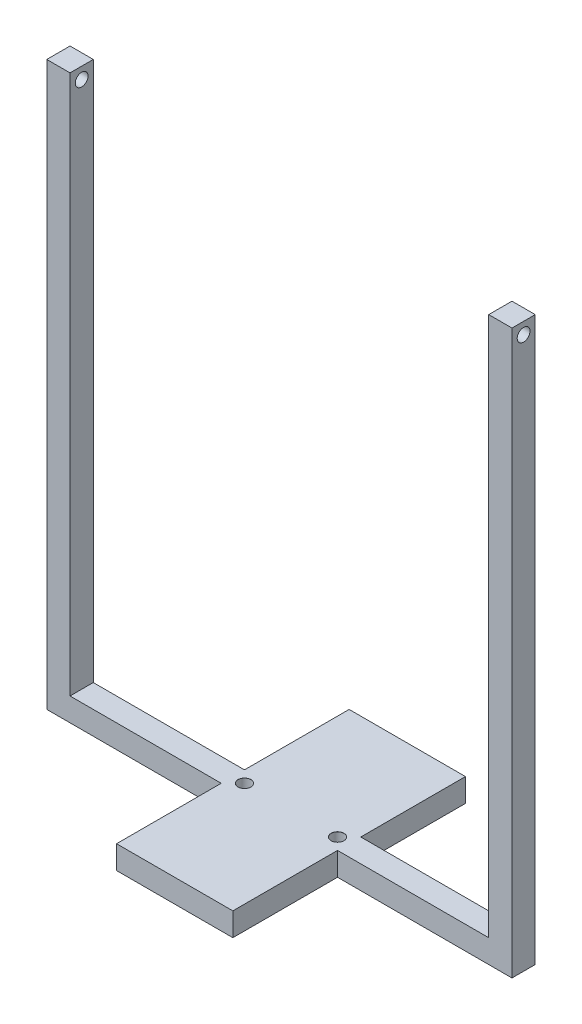
from build123d import *

# Parameters (mm, degrees)
SKETCH1_R                      = 10
BOSS_EXTRUDE1_DEPTH            = 10
SKETCH4_R                      = 15
BOSS_EXTRUDE4_DEPTH            = 5
BOSS_EXTRUDE2_DEPTH            = 10
SKETCH3_W                      = 10
SKETCH3_H                      = 10
BOSS_EXTRUDE3_DEPTH            = 232
M5_CLEARANCE_HOLE1_D           = 5.5
M5_CLEARANCE_HOLE1_CSINK_D     = 5.55
M5_CLEARANCE_HOLE1_CSINK_ANGLE = 90
M5_CLEARANCE_HOLE2_D           = 5.5
M5_CLEARANCE_HOLE2_CSINK_D     = 5.55
M5_CLEARANCE_HOLE2_CSINK_ANGLE = 90


with BuildPart() as part:
    # Sketch1 → Boss-Extrude1 (new body)
    with BuildSketch(Plane(origin=(0, 0, 0), x_dir=(1, 0, 0), z_dir=(0, 1, 0))):
        with Locations(Location((0, 0, 0), (0, 0, 270))):
            Circle(SKETCH1_R)
    extrude(amount=BOSS_EXTRUDE1_DEPTH)

    # Sketch4 → Boss-Extrude4 (add)
    with BuildSketch(Plane(origin=(0, 10, 0), x_dir=(1, 0, 0), z_dir=(0, 1, 0))):
        with Locations(Location((0, 0, 0), (0, 0, 270))):
            Circle(SKETCH4_R)
    extrude(amount=BOSS_EXTRUDE4_DEPTH)

    # Sketch2 → Boss-Extrude2 (add)
    with BuildSketch(Plane(origin=(0, 15, 0), x_dir=(1, 0, 0), z_dir=(0, 1, 0))):
        with BuildLine():
            Line((-25, 50), (-25, 5))
            Line((-25, 5), (-14.142135624, 5))
            ThreePointArc((-14.142135624, 5), (0, 15), (14.142135624, 5))
            Line((14.142135624, 5), (25, 5))
            Line((25, 5), (25, 50))
            Line((25, 50), (-25, 50))
        make_face()
        with BuildLine():
            Line((-14.142135624, 5), (-25, 5))
            Line((-25, 5), (-100, 5))
            Line((-100, 5), (-100, -5))
            Line((-100, -5), (-25, -5))
            Line((-25, -5), (-14.142135624, -5))
            ThreePointArc((-14.142135624, -5), (-15, 0), (-14.142135624, 5))
        make_face()
        with BuildLine():
            ThreePointArc((14.142135624, -5), (0, -15), (-14.142135624, -5))
            Line((-14.142135624, -5), (-25, -5))
            Line((-25, -5), (-25, -50))
            Line((-25, -50), (25, -50))
            Line((25, -50), (25, -5))
            Line((25, -5), (14.142135624, -5))
        make_face()
        with BuildLine():
            Line((25, 5), (14.142135624, 5))
            ThreePointArc((14.142135624, 5), (14.783978395, 2.536529681), (15, 0))
            ThreePointArc((15, 0), (14.783978395, -2.536529681), (14.142135624, -5))
            Line((14.142135624, -5), (25, -5))
            Line((25, -5), (100, -5))
            Line((100, -5), (100, 5))
            Line((100, 5), (25, 5))
        make_face()
        with BuildLine():
            Line((14.142135624, 5), (-14.142135624, 5))
            ThreePointArc((-14.142135624, 5), (-15, 0), (-14.142135624, -5))
            Line((-14.142135624, -5), (14.142135624, -5))
            ThreePointArc((14.142135624, -5), (14.783978395, -2.536529681), (15, 0))
            ThreePointArc((15, 0), (14.783978395, 2.536529681), (14.142135624, 5))
        make_face()
        with BuildLine():
            ThreePointArc((14.142135624, 5), (0, 15), (-14.142135624, 5))
            Line((-14.142135624, 5), (14.142135624, 5))
        make_face()
        with BuildLine():
            Line((14.142135624, -5), (-14.142135624, -5))
            ThreePointArc((-14.142135624, -5), (0, -15), (14.142135624, -5))
        make_face()
    extrude(amount=BOSS_EXTRUDE2_DEPTH)

    # Sketch3 → Boss-Extrude3 (add)
    with BuildSketch(Plane(origin=(0, 25, 0), x_dir=(1, 0, 0), z_dir=(0, 1, 0))):
        with Locations((-95, 0)):
            Rectangle(SKETCH3_W, SKETCH3_H)
        with Locations((95, 0)):
            Rectangle(SKETCH3_W, SKETCH3_H)
    extrude(amount=BOSS_EXTRUDE3_DEPTH)

    # M5 Clearance Hole1 (through all)
    with Locations(Plane.ZY.offset(100)):
        with Locations((0, 252)):
            CounterSinkHole(M5_CLEARANCE_HOLE1_D / 2, M5_CLEARANCE_HOLE1_CSINK_D / 2, counter_sink_angle=M5_CLEARANCE_HOLE1_CSINK_ANGLE)

    # M5 Clearance Hole2 (through all)
    with Locations(Plane(origin=(0, 25, 0), x_dir=(1, 0, 0), z_dir=(0, 1, 0))):
        with Locations((-20, 0), (20, 0)):
            CounterSinkHole(M5_CLEARANCE_HOLE2_D / 2, M5_CLEARANCE_HOLE2_CSINK_D / 2, counter_sink_angle=M5_CLEARANCE_HOLE2_CSINK_ANGLE)


solid = part.part
